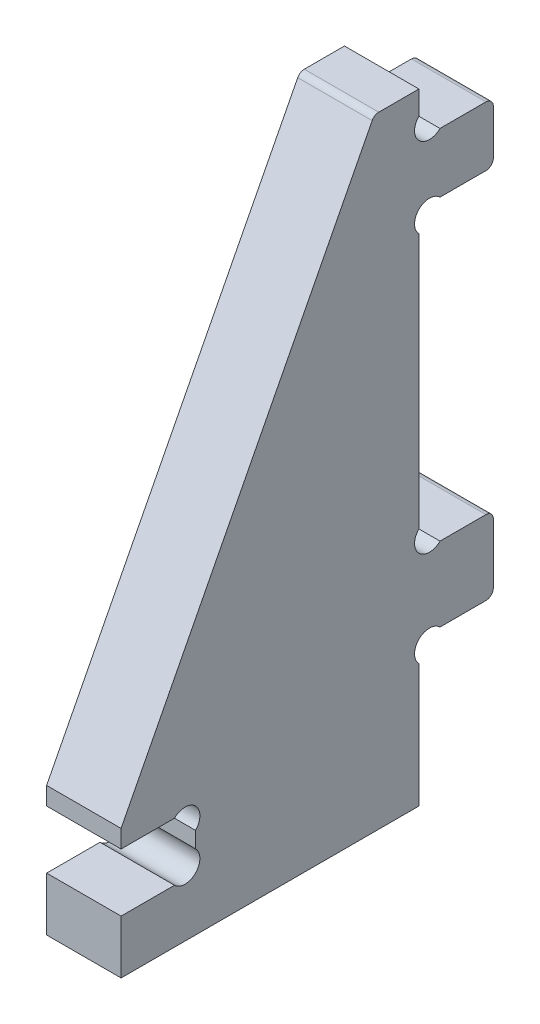
from build123d import *

# Parameters (mm, degrees)
EXTRUDE_1_DEPTH     = 5
SKETCH_7_W          = 5
SKETCH_7_H          = 10.8
CUT_EXTRUDE_1_DEPTH = 5
SKETCH_8_W          = 15
SKETCH_8_H          = 3.3
CUT_EXTRUDE_2_DEPTH = 5
SKETCH_10_W         = 5
SKETCH_10_H         = 3.6
EXTRUDE_2_DEPTH     = 5
SKETCH_9_R          = 1
CUT_EXTRUDE_3_DEPTH = 5
SKETCH_15_W         = 5
SKETCH_15_H         = 4
SKETCH_15_H_2       = 5
EXTRUDE_6_DEPTH     = 5
SKETCH_11_W         = 5
SKETCH_11_H         = 5
SKETCH_11_H_2       = 4
EXTRUDE_3_DEPTH     = 5
SKETCH_12_R         = 1
CUT_EXTRUDE_4_DEPTH = 5
FILLET_1_R          = 0.5


with BuildPart() as part:
    # 스케치1 → 보스-돌출1 (new body)
    with BuildSketch(Plane(origin=(0, 0, 0), x_dir=(0, 0, -1), z_dir=(1, 0, 0))):
        Polygon((0, 0), (0, 12), (17, 45), (20, 45), (20, 0), align=None)
    extrude(amount=EXTRUDE_1_DEPTH)

    # 스케치7 → 컷-돌출1 (cut)
    with BuildSketch(Plane(origin=(5, 0, 0), x_dir=(0, 0, -1), z_dir=(1, 0, 0))):
        with Locations((2.5, 5.4)):
            Rectangle(SKETCH_7_W, SKETCH_7_H)
    extrude(amount=-CUT_EXTRUDE_1_DEPTH, mode=Mode.SUBTRACT)

    # 스케치8 → 컷-돌출2 (cut)
    with BuildSketch(Plane(origin=(5, 0, 0), x_dir=(0, 0, -1), z_dir=(1, 0, 0))):
        with Locations((12.5, 1.65)):
            Rectangle(SKETCH_8_W, SKETCH_8_H)
    extrude(amount=-CUT_EXTRUDE_2_DEPTH, mode=Mode.SUBTRACT)

    # 스케치10 → 보스-돌출2 (add)
    with BuildSketch(Plane(origin=(5, 0, 0), x_dir=(0, 0, -1), z_dir=(1, 0, 0))):
        with Locations((2.5, 5.1)):
            Rectangle(SKETCH_10_W, SKETCH_10_H)
    extrude(amount=-EXTRUDE_2_DEPTH)

    # 스케치9 → 컷-돌출3 (cut)
    with BuildSketch(Plane(origin=(5, 0, 0), x_dir=(0, 0, -1), z_dir=(1, 0, 0))):
        with Locations((4.292893219, 10.092893219)):
            Circle(SKETCH_9_R)
        with Locations((4.292893219, 7.607106781)):
            Circle(SKETCH_9_R)
    extrude(amount=-CUT_EXTRUDE_3_DEPTH, mode=Mode.SUBTRACT)

    # 스케치15 → 보스-돌출6 (add)
    with BuildSketch(Plane(origin=(5, 0, 0), x_dir=(0, 0, -1), z_dir=(1, 0, 0))):
        with Locations((22.5, 40)):
            Rectangle(SKETCH_15_W, SKETCH_15_H)
        with Locations((22.5, 15.5)):
            Rectangle(SKETCH_15_W, SKETCH_15_H_2)
    extrude(amount=-EXTRUDE_6_DEPTH)

    # 스케치11 → 보스-돌출3 (add)
    with BuildSketch(Plane(origin=(5, 0, 0), x_dir=(0, 0, -1), z_dir=(1, 0, 0))):
        with Locations((22.5, 15.5)):
            Rectangle(SKETCH_11_W, SKETCH_11_H)
        with Locations((22.5, 40)):
            Rectangle(SKETCH_11_W, SKETCH_11_H_2)
    extrude(amount=-EXTRUDE_3_DEPTH)

    # 스케치12 → 컷-돌출4 (cut)
    with BuildSketch(Plane(origin=(5, 0, 0), x_dir=(0, 0, -1), z_dir=(1, 0, 0))):
        with Locations((20.707106781, 18.707106781)):
            Circle(SKETCH_12_R)
        with Locations((20.707106781, 12.292893219)):
            Circle(SKETCH_12_R)
        with Locations((20.707106781, 37.292893219)):
            Circle(SKETCH_12_R)
        with Locations((20.707106781, 42.707106781)):
            Circle(SKETCH_12_R)
    extrude(amount=-CUT_EXTRUDE_4_DEPTH, mode=Mode.SUBTRACT)

    # 필렛1
    fillet_1_edges = [part.edges().sort_by_distance(p)[0] for p in [
        (2.5, 13, -25),
        (2.5, 38, -25),
        (2.5, 18, -25),
        (2.5, 42, -25),
        (2.5, 45, -17),
    ]]
    fillet(fillet_1_edges, radius=FILLET_1_R)


solid = part.part
